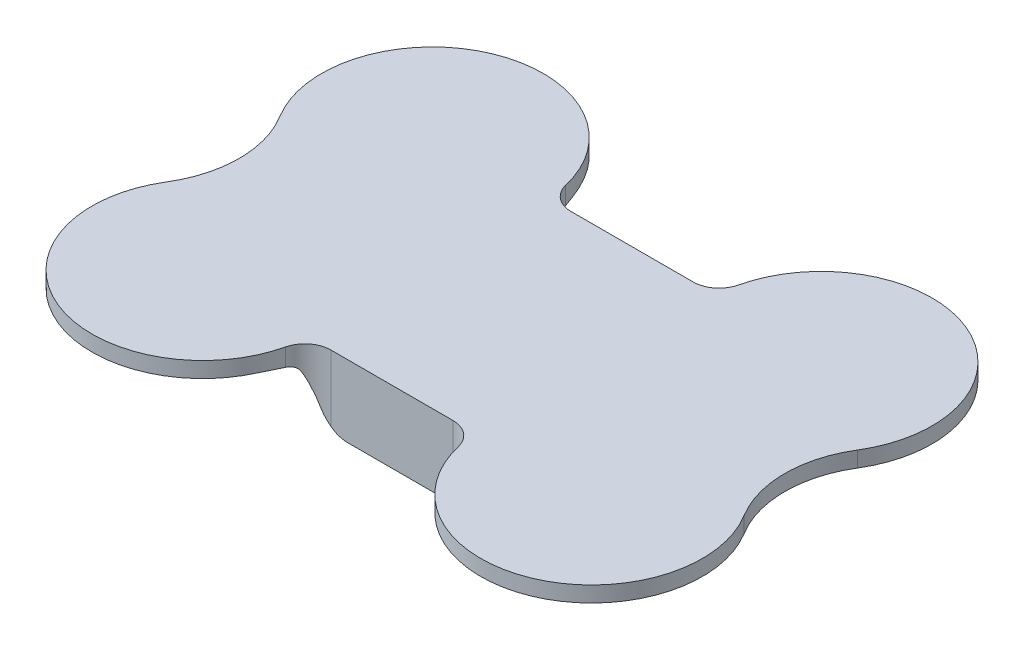
from build123d import *

# Parameters (mm, degrees)
BOSS_EXTRUDE1_DEPTH     = 29
CUT_EXTRUDE3_DEPTH      = 149.365258737
CUT_EXTRUDE3_DEPTH_BACK = 149.365258737


with BuildPart() as part:
    # Sketch2 → Boss-Extrude1 (new body)
    with BuildSketch(Plane(origin=(0, 0, 0), x_dir=(1, 0, 0), z_dir=(0, 1, 0))):
        with BuildLine():
            Line((-23.389824888, -46), (23.389824888, -46))
            ThreePointArc((23.389824888, -46), (29.600414922, -48.162361872), (33.125096338, -53.714285714))
            ThreePointArc((33.125096338, -53.714285714), (90.695873622, -83.293048719), (110.70300535, -21.738095238))
            ThreePointArc((110.70300535, -21.738095238), (104.55417528, 0), (110.70300535, 21.738095238))
            ThreePointArc((110.70300535, 21.738095238), (90.695873622, 83.293048719), (33.125096338, 53.714285714))
            ThreePointArc((33.125096338, 53.714285714), (29.600414922, 48.162361872), (23.389824888, 46))
            Line((23.389824888, 46), (-23.389824888, 46))
            ThreePointArc((-23.389824888, 46), (-29.600414922, 48.162361872), (-33.125096338, 53.714285714))
            ThreePointArc((-33.125096338, 53.714285714), (-90.695873622, 83.293048719), (-110.70300535, 21.738095238))
            ThreePointArc((-110.70300535, 21.738095238), (-104.55417528, 0), (-110.70300535, -21.738095238))
            ThreePointArc((-110.70300535, -21.738095238), (-90.695873622, -83.293048719), (-33.125096338, -53.714285714))
            ThreePointArc((-33.125096338, -53.714285714), (-29.600414922, -48.162361872), (-23.389824888, -46))
        make_face()
    extrude(amount=BOSS_EXTRUDE1_DEPTH)

    # Sketch4 → Cut-Extrude3 (cut, two sides: drawn at the far end of the back side and taken through both)
    with BuildSketch(Plane.XY.offset(-CUT_EXTRUDE3_DEPTH_BACK)):
        with BuildLine():
            Line((-597.255249838, 23), (-117, 23))
            Line((-117, 23), (-35.764946788, 23))
            ThreePointArc((-35.764946788, 23), (-32.942865818, 22.127451877), (-31.105745429, 19.814343599))
            Line((-31.105745429, 19.814343599), (-26.432815133, 7.814343599))
            ThreePointArc((-26.432815133, 7.814343599), (-22.758574356, 3.188127043), (-17.114412415, 1.443030797))
            Line((-17.114412415, 1.443030797), (17.114412415, 1.443030797))
            ThreePointArc((17.114412415, 1.443030797), (22.758574356, 3.188127043), (26.432815133, 7.814343599))
            Line((26.432815133, 7.814343599), (31.105745429, 19.814343599))
            ThreePointArc((31.105745429, 19.814343599), (32.942865818, 22.127451877), (35.764946788, 23))
            Line((35.764946788, 23), (117, 23))
            Line((117, 23), (597.255249838, 23))
            Line((597.255249838, 23), (597.255249838, -937.510499676))
            Line((597.255249838, -937.510499676), (-597.255249838, -937.510499676))
            Line((-597.255249838, -937.510499676), (-597.255249838, 23))
        make_face()
    extrude(amount=CUT_EXTRUDE3_DEPTH + CUT_EXTRUDE3_DEPTH_BACK, mode=Mode.SUBTRACT)


solid = part.part
